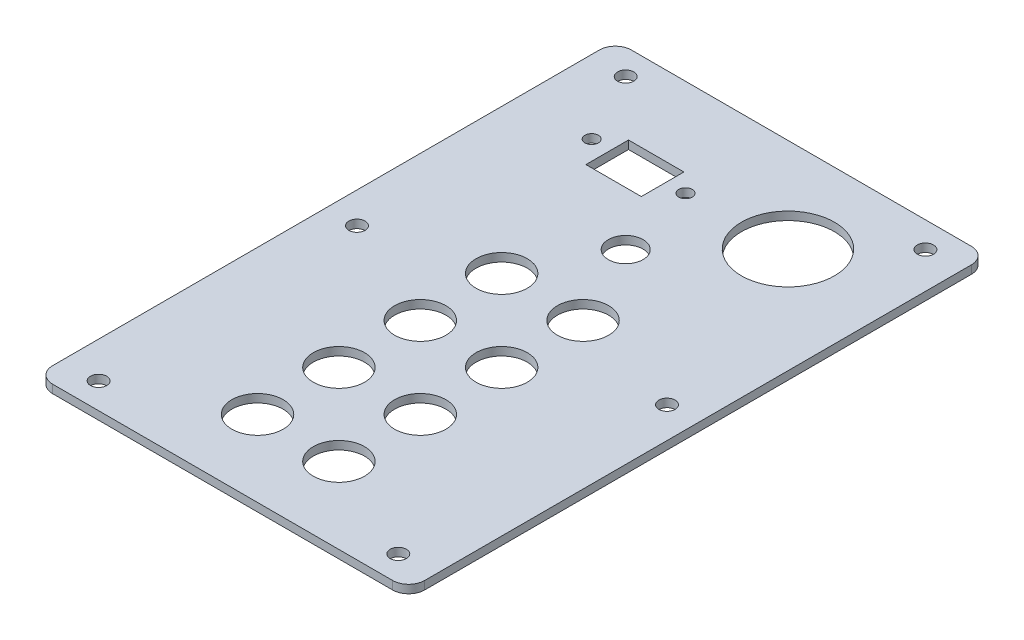
from build123d import *

# Parameters (mm, degrees)
SKETCH1_W           = 114.3
SKETCH1_H           = 177.8
SKETCH1_R           = 7.874
SKETCH1_R_2         = 5.334
SKETCH1_R_3         = 14.2875
SKETCH1_R_4         = 2.4892
SKETCH1_R_5         = 2.06375
SKETCH1_W_2         = 17.018
SKETCH1_H_2         = 13.081
BOSS_EXTRUDE1_DEPTH = 2.54
FILLET1_R           = 4.92


with BuildPart() as part:
    # Sketch1 → Boss-Extrude1 (new body)
    with BuildSketch(Plane(origin=(0, 0, 0), x_dir=(1, 0, 0), z_dir=(0, 1, 0))):
        with Locations((0, 12.933192571)):
            Rectangle(SKETCH1_W, SKETCH1_H)
        with Locations(Location((-12.7, 22.458192571, 0), (0, 0, 270))):
            Circle(SKETCH1_R, mode=Mode.SUBTRACT)
        with Locations(Location((0, 47.858192571, 0), (0, 0, 270))):
            Circle(SKETCH1_R_2, mode=Mode.SUBTRACT)
        with Locations(Location((24.765, 72.940692571, 0), (0, 0, 270))):
            Circle(SKETCH1_R_3, mode=Mode.SUBTRACT)
        with Locations(Location((-46.0375, -68.029307429, 0), (0, 0, 270))):
            Circle(SKETCH1_R_4, mode=Mode.SUBTRACT)
        with Locations(Location((-46.0375, 93.895692571, 0), (0, 0, 270))):
            Circle(SKETCH1_R_4, mode=Mode.SUBTRACT)
        with Locations(Location((-47.625, 12.933192571, 0), (0, 0, 270))):
            Circle(SKETCH1_R_4, mode=Mode.SUBTRACT)
        with Locations(Location((46.0375, 93.895692571, 0), (0, 0, 90))):
            Circle(SKETCH1_R_4, mode=Mode.SUBTRACT)
        with Locations(Location((47.625, 12.933192571, 0), (0, 0, 90))):
            Circle(SKETCH1_R_4, mode=Mode.SUBTRACT)
        with Locations(Location((46.0375, -68.029307429, 0), (0, 0, 90))):
            Circle(SKETCH1_R_4, mode=Mode.SUBTRACT)
        with Locations(Location((-5.801987124, 72.035346476, 0), (0, 0, 270))):
            Circle(SKETCH1_R_5, mode=Mode.SUBTRACT)
        with Locations(Location((-34.630987124, 72.035346476, 0), (0, 0, 90))):
            Circle(SKETCH1_R_5, mode=Mode.SUBTRACT)
        with Locations(Location((12.3, 22.458192571, 0), (0, 0, 270))):
            Circle(SKETCH1_R, mode=Mode.SUBTRACT)
        with Locations(Location((12.3, -2.541807429, 0), (0, 0, 270))):
            Circle(SKETCH1_R, mode=Mode.SUBTRACT)
        with Locations(Location((12.3, -27.541807429, 0), (0, 0, 270))):
            Circle(SKETCH1_R, mode=Mode.SUBTRACT)
        with Locations(Location((12.3, -52.541807429, 0), (0, 0, 270))):
            Circle(SKETCH1_R, mode=Mode.SUBTRACT)
        with Locations(Location((-12.7, -2.541807429, 0), (0, 0, 270))):
            Circle(SKETCH1_R, mode=Mode.SUBTRACT)
        with Locations(Location((-12.7, -27.541807429, 0), (0, 0, 270))):
            Circle(SKETCH1_R, mode=Mode.SUBTRACT)
        with Locations(Location((-12.7, -52.541807429, 0), (0, 0, 270))):
            Circle(SKETCH1_R, mode=Mode.SUBTRACT)
        with Locations((-20.216487124, 70.907248902)):
            Rectangle(SKETCH1_W_2, SKETCH1_H_2, mode=Mode.SUBTRACT)
    extrude(amount=BOSS_EXTRUDE1_DEPTH)

    # Fillet1
    fillet1_edges = [part.edges().sort_by_distance(p)[0] for p in [
        (-57.15, 1.27, -101.833192571),
        (57.15, 1.27, -101.833192571),
        (57.15, 1.27, 75.966807429),
        (-57.15, 1.27, 75.966807429),
    ]]
    fillet(fillet1_edges, radius=FILLET1_R)


solid = part.part
